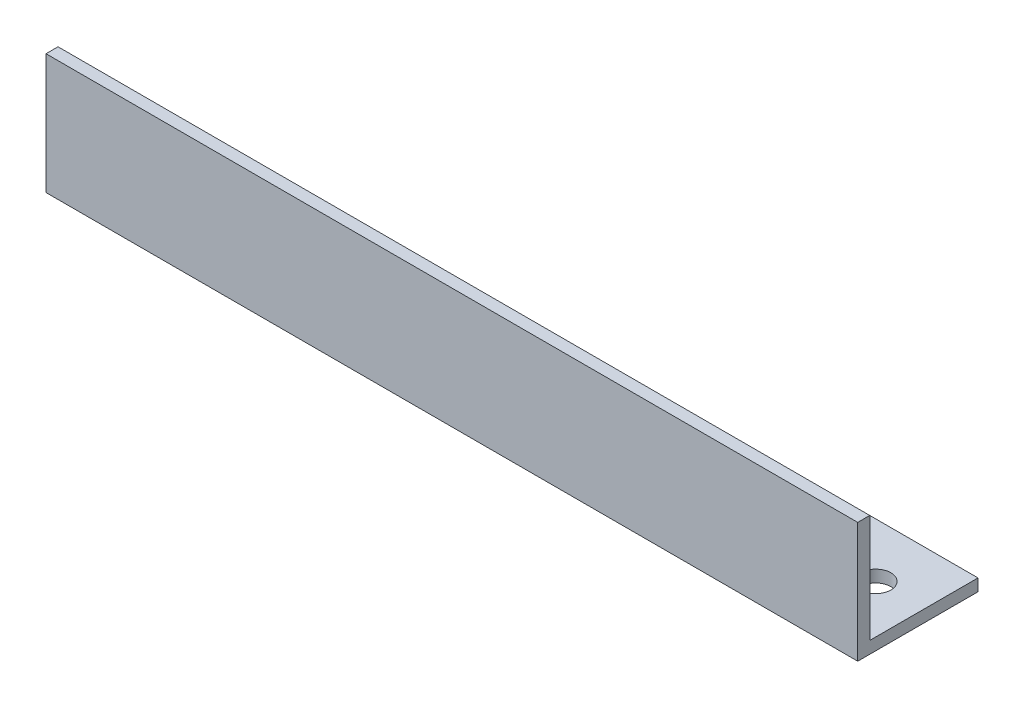
from build123d import *

# Parameters (mm, degrees)
BOSS_EXTRUDE1_DEPTH = 135
SKETCH3_R           = 2.5
CUT_EXTRUDE1_DEPTH  = 2


with BuildPart() as part:
    # Sketch1 → Boss-Extrude1 (new body)
    with BuildSketch(Plane(origin=(0, 0, 0), x_dir=(0, 0, -1), z_dir=(1, 0, 0))):
        Polygon((0, 20), (0, 0), (20, 0), (20, 2), (2, 2), (2, 20), align=None)
    extrude(amount=-BOSS_EXTRUDE1_DEPTH)

    # Sketch3 → Cut-Extrude1 (cut)
    with BuildSketch(Plane(origin=(0, 2, 0), x_dir=(1, 0, 0), z_dir=(0, 1, 0))):
        with Locations(Location((-8, 11, 0), (0, 0, 270))):
            Circle(SKETCH3_R)
        with Locations(Location((-30, 11, 0), (0, 0, 270))):
            Circle(SKETCH3_R)
    extrude(amount=-CUT_EXTRUDE1_DEPTH, mode=Mode.SUBTRACT)


solid = part.part
